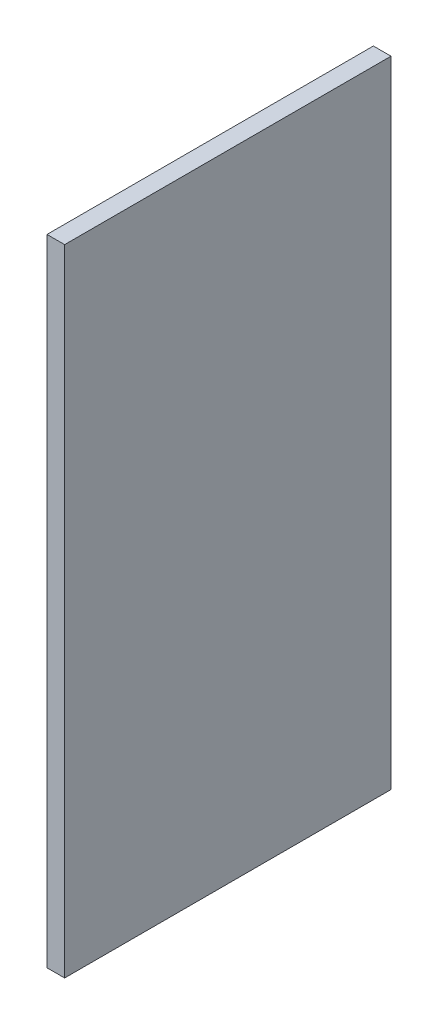
from build123d import *

# Parameters (mm, degrees)
SKETCH1_W           = 12.7
SKETCH1_H           = 234.95
BOSS_EXTRUDE1_DEPTH = 457.2


with BuildPart() as part:
    # Sketch1 → Boss-Extrude1 (new body)
    with BuildSketch(Plane(origin=(0, 25.4, 0), x_dir=(1, 0, 0), z_dir=(0, 1, 0))):
        with Locations((298.45, -9.525)):
            Rectangle(SKETCH1_W, SKETCH1_H)
    extrude(amount=BOSS_EXTRUDE1_DEPTH)


solid = part.part
